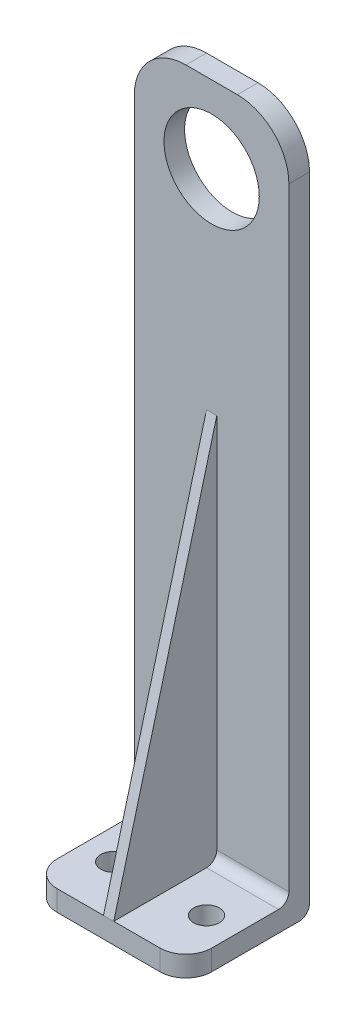
from build123d import *

# Parameters (mm, degrees)
SKETCH_1_W          = 30
SKETCH_1_H          = 4
EXTRUDE_1_DEPTH     = 20
SKETCH_1_3_W        = 30
SKETCH_1_3_H        = 135
SKETCH_1_3_R        = 9.25
EXTRUDE_2_DEPTH     = 4
RIB_3_REACH         = 73.981
SKETCH_2_WALL_W     = 223.58267397
SKETCH_2_WALL_H     = 2
SKETCH_3_R          = 2.5
CUT_EXTRUDE_1_DEPTH = 4
FILLET_1_R          = 5
FILLET_2_R          = 2
FILLET_3_R          = 10


with BuildPart() as part:
    # 스케치1 → 보스-돌출1 (new body)
    with BuildSketch(Plane.XY):
        with Locations((0, -65.5)):
            Rectangle(SKETCH_1_W, SKETCH_1_H)
    extrude(amount=EXTRUDE_1_DEPTH)

    # 스케치1<3> → 보스-돌출2 (add)
    with BuildSketch(Plane.XY):
        Rectangle(SKETCH_1_3_W, SKETCH_1_3_H)
        with Locations((0, 52.5)):
            Circle(SKETCH_1_3_R, mode=Mode.SUBTRACT)
    extrude(amount=-EXTRUDE_2_DEPTH)

    # 스케치2 wall → 보강대3 (add, up to next)
    with BuildSketch(Plane(origin=(0, -26, 10), x_dir=(0, -0.966234939601, 0.25766265056), z_dir=(0, -0.25766265056, -0.966234939601)), mode=Mode.PRIVATE) as rib_3_sk1:
        Rectangle(SKETCH_2_WALL_W, SKETCH_2_WALL_H)
    rib_3_tool1 = extrude(rib_3_sk1.sketch, amount=RIB_3_REACH, mode=Mode.PRIVATE) - part.part
    add(rib_3_tool1.solids().sort_by_distance((0, -26, 10))[0])

    # 스케치3 → 컷-돌출1 (cut)
    with BuildSketch(Plane.XZ.offset(67.5)):
        with Locations((-9, 10)):
            Circle(SKETCH_3_R)
        with Locations((9, 10)):
            Circle(SKETCH_3_R)
    extrude(amount=-CUT_EXTRUDE_1_DEPTH, mode=Mode.SUBTRACT)

    # 필렛1
    fillet_1_edges = [part.edges().sort_by_distance(p)[0] for p in [
        (15, -65.5, 20),
        (-15, -65.5, 20),
    ]]
    fillet(fillet_1_edges, radius=FILLET_1_R)

    # 필렛2
    fillet_2_edges = [part.edges().sort_by_distance(p)[0] for p in [
        (8, -63.5, 0),
        (-8, -63.5, 0),
        (0, -67.5, -4),
    ]]
    fillet(fillet_2_edges, radius=FILLET_2_R)

    # 필렛3
    fillet_3_edges = [part.edges().sort_by_distance(p)[0] for p in [
        (15, 67.5, -2),
        (-15, 67.5, -2),
    ]]
    fillet(fillet_3_edges, radius=FILLET_3_R)


solid = part.part
